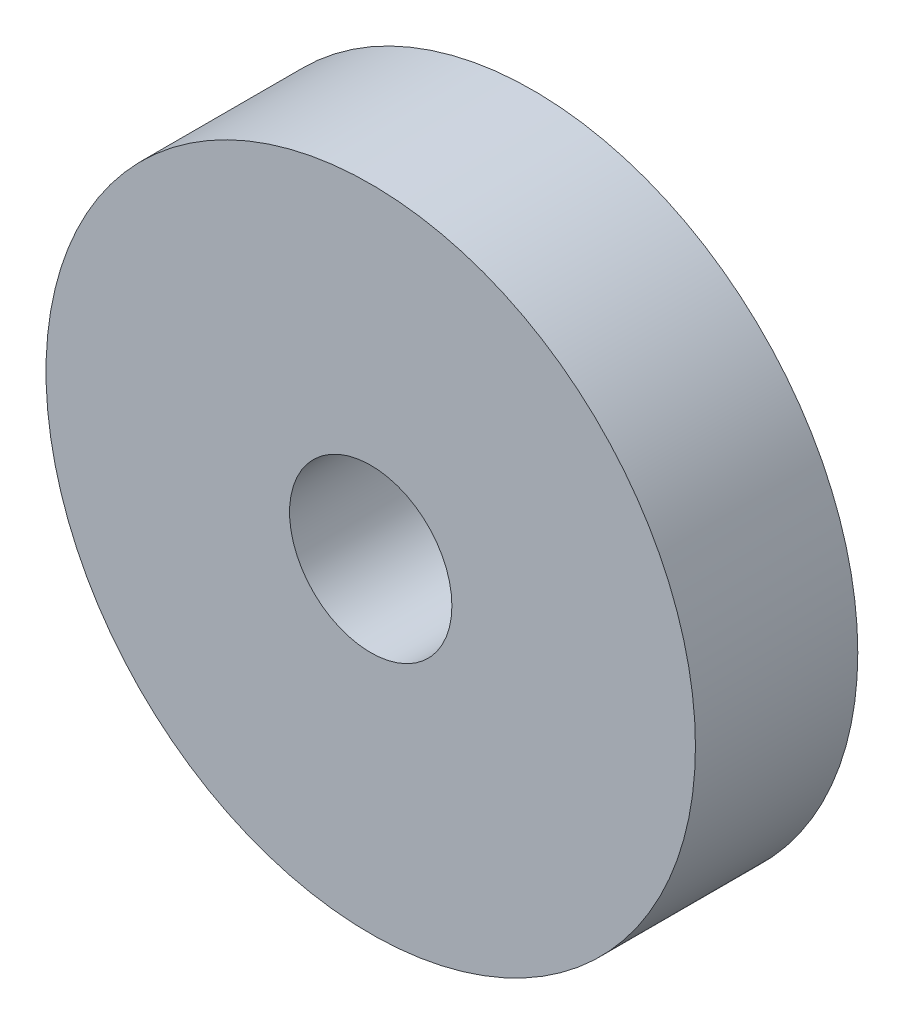
from build123d import *

# Parameters (mm, degrees)
SKETCH_1_R      = 10
SKETCH_1_R_2    = 2.5
EXTRUDE_1_DEPTH = 5


with BuildPart() as part:
    # 草图1 → 凸台-拉伸1 (new body)
    with BuildSketch(Plane.XY):
        Circle(SKETCH_1_R)
        Circle(SKETCH_1_R_2, mode=Mode.SUBTRACT)
    extrude(amount=EXTRUDE_1_DEPTH)


solid = part.part
